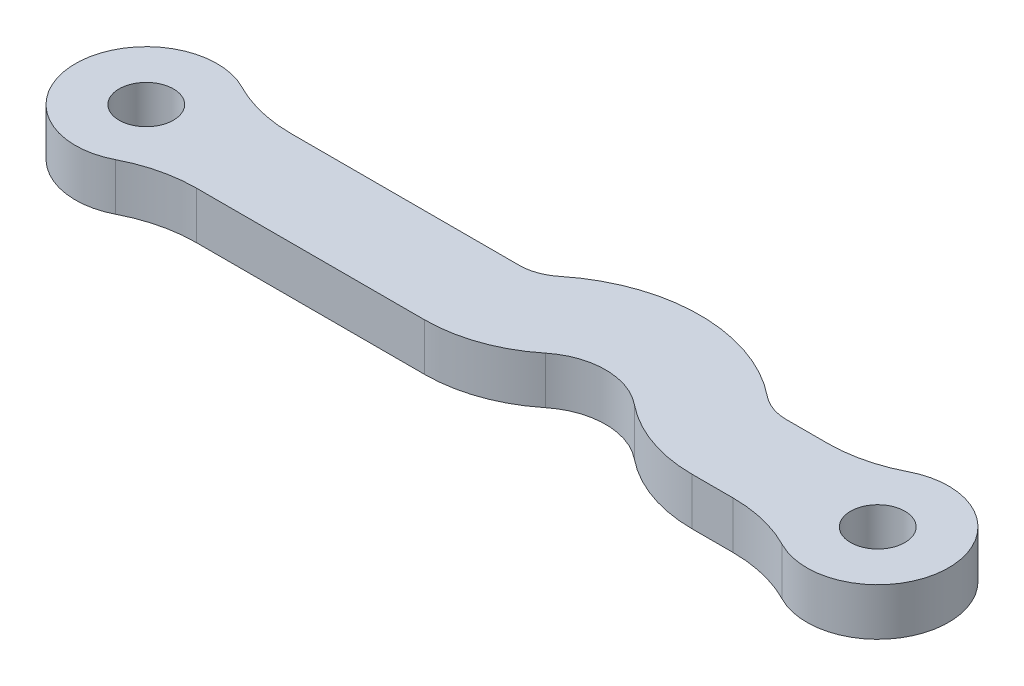
from build123d import *

# Parameters (mm, degrees)
SKETCH_1_R      = 1.15
EXTRUDE_1_DEPTH = 2
FILLET_1_R      = 6
FILLET_2_R      = 6
FILLET_3_R      = 2


with BuildPart() as part:
    # Эскиз1 → Бобышка-Вытянуть1 (new body)
    with BuildSketch(Plane(origin=(0, 0, 0), x_dir=(1, 0, 0), z_dir=(0, 1, 0))):
        with BuildLine():
            Line((2.236067977, -2), (16.605931339, -2))
            ThreePointArc((16.605931339, -2), (19.434358463, 0), (22.262785588, -2))
            Line((22.262785588, -2), (28.713932023, -2))
            ThreePointArc((28.713932023, -2), (33.95, 0), (28.713932023, 2))
            Line((28.713932023, 2), (24.333337949, 2))
            ThreePointArc((24.333337949, 2), (19.434358463, 4), (14.535378978, 2))
            Line((14.535378978, 2), (2.236067977, 2))
            ThreePointArc((2.236067977, 2), (-3, 0), (2.236067977, -2))
        make_face()
        with Locations(Location((0, 0, 0), (0, 0, 270))):
            Circle(SKETCH_1_R, mode=Mode.SUBTRACT)
        with Locations(Location((30.95, 0, 0), (0, 0, 270))):
            Circle(SKETCH_1_R, mode=Mode.SUBTRACT)
    extrude(amount=EXTRUDE_1_DEPTH)

    # Скругление1
    fillet_1_edges = [part.edges().sort_by_distance(p)[0] for p in [
        (2.236067977, 1, 2),
        (2.236067977, 1, -2),
        (28.713932023, 1, -2),
        (28.713932023, 1, 2),
    ]]
    fillet(fillet_1_edges, radius=FILLET_1_R)

    # Скругление2
    fillet_2_edges = [part.edges().sort_by_distance(p)[0] for p in [
        (22.262785588, 1, 2),
        (16.605931339, 1, 2),
    ]]
    fillet(fillet_2_edges, radius=FILLET_2_R)

    # Скругление3
    fillet_3_edges = [part.edges().sort_by_distance(p)[0] for p in [
        (14.535378978, 1, -2),
        (24.333337949, 1, -2),
    ]]
    fillet(fillet_3_edges, radius=FILLET_3_R)


solid = part.part
